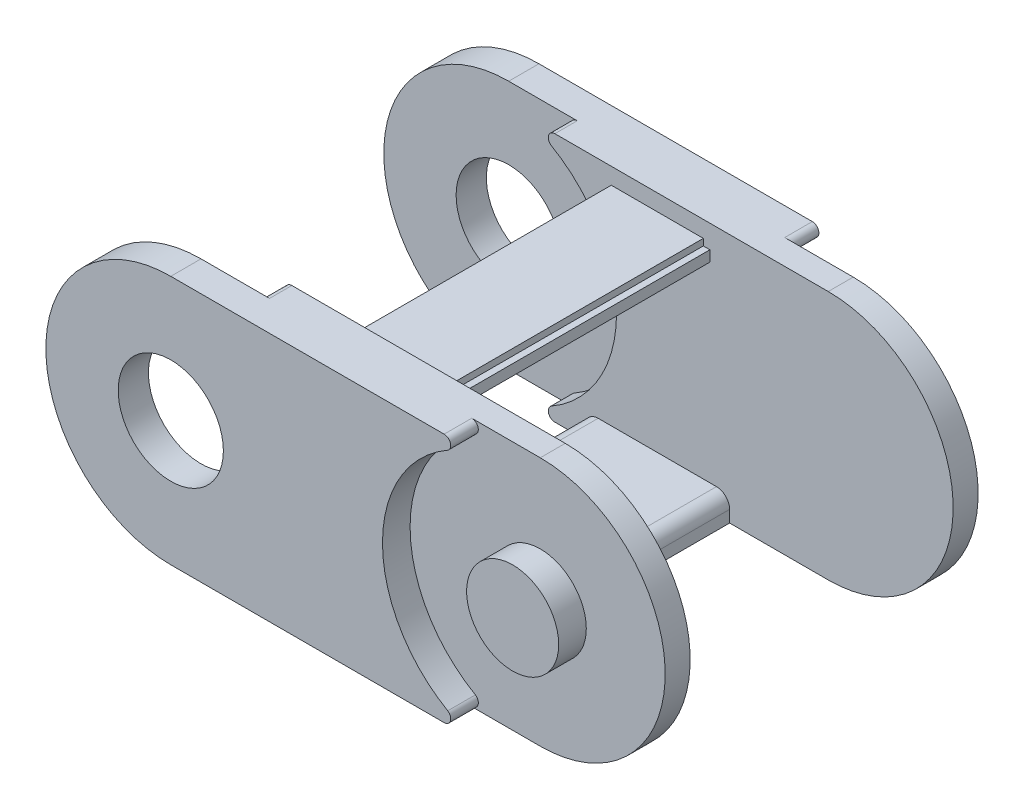
from build123d import *

# Parameters (mm, degrees)
SALIENTE_EXTRUIR1_DEPTH           = 4
CROQUIS2_W                        = 26
CROQUIS2_H                        = 1.9
SALIENTE_EXTRUIR2_DEPTH           = 20
SALIENTE_EXTRUIR3_DEPTH           = 20
SALIENTE_EXTRUIR4_START           = 1.9
SALIENTE_EXTRUIR4_DEPTH           = 1.9
CROQUIS5_W                        = 20
CROQUIS5_H                        = 1.9
CORTAR_EXTRUIR1_DEPTH             = 5.21
CORTAR_EXTRUIR2_START             = -1.7
CORTAR_EXTRUIR2_DEPTH             = 1.7
CROQUIS7_W                        = 20
CROQUIS7_H                        = 1.9
CORTAR_EXTRUIR3_DEPTH             = 2.29
CORTAR_EXTRUIR4_DEPTH             = 20
CORTAR_EXTRUIR5_DEPTH             = 20
CORTAR_EXTRUIR6_DEPTH             = 1.7
CORTAR_EXTRUIR7_START             = -2.1
CORTAR_EXTRUIR7_DEPTH             = 2.1
CROQUIS12_W                       = 20
CROQUIS12_H                       = 1.9
CORTAR_EXTRUIR8_DEPTH             = 7.5
SALIENTE_EXTRUIR5_START           = 2.1
SALIENTE_EXTRUIR5_DEPTH           = 2.1
CROQUIS14_W                       = 3.5
CROQUIS14_H                       = 2.1
CROQUIS15_W                       = 3.5
CROQUIS15_H                       = 2.1
DI_METRO_DE_TALADRO_7_0_7_1_D     = 7
DI_METRO_DE_TALADRO_7_0_7_1_DEPTH = 2.3
DI_METRO_DE_TALADRO_7_0_7_2_D     = 7
DI_METRO_DE_TALADRO_7_0_7_2_DEPTH = 28
NERVIO1_REACH                     = 30.151
CROQUIS20_WALL_W                  = 78.302753042
CROQUIS20_WALL_H                  = 7
REDONDEO1_R                       = 1
CROQUIS21_R                       = 4
CORTAR_EXTRUIR9_DEPTH             = 34


with BuildPart() as part:
    # Croquis1 → Saliente-Extruir1 (new body)
    with BuildSketch(Plane.XY.offset(-10)):
        with BuildLine():
            Line((-13, -9.5), (13, -9.5))
            ThreePointArc((13, -9.5), (22.5, 0), (13, 9.5))
            Line((13, 9.5), (-13, 9.5))
            ThreePointArc((-13, 9.5), (-22.5, 0), (-13, -9.5))
        make_face()
    extrude(amount=-SALIENTE_EXTRUIR1_DEPTH)

    # Croquis2 → Saliente-Extruir2 (add)
    with BuildSketch(Plane.XY.offset(-10)):
        with Locations((0, -8.55)):
            Rectangle(CROQUIS2_W, CROQUIS2_H)
    extrude(amount=SALIENTE_EXTRUIR2_DEPTH)

    # Croquis3 → Saliente-Extruir3 (add)
    with BuildSketch(Plane.XY.offset(-10)):
        with BuildLine():
            Line((-6.2731571, 7.75), (6.2731571, 7.75))
            ThreePointArc((6.2731571, 7.75), (0, 6.4), (-6.2731571, 7.75))
        make_face()
    extrude(amount=SALIENTE_EXTRUIR3_DEPTH)

    # Croquis4 → Saliente-Extruir4 (add)
    with BuildSketch(Plane.XY.offset(10).offset(SALIENTE_EXTRUIR4_START)):
        with BuildLine():
            Line((-13, 9.5), (13, 9.5))
            ThreePointArc((13, 9.5), (22.5, 0), (13, -9.5))
            Line((13, -9.5), (-13, -9.5))
            ThreePointArc((-13, -9.5), (-22.5, 0), (-13, 9.5))
        make_face()
    extrude(amount=-SALIENTE_EXTRUIR4_DEPTH)

    # Croquis5 → Cortar-Extruir1 (cut)
    with BuildSketch(Plane.ZY.offset(13)):
        with Locations((0, -8.55)):
            Rectangle(CROQUIS5_W, CROQUIS5_H)
    extrude(amount=-CORTAR_EXTRUIR1_DEPTH, mode=Mode.SUBTRACT)

    # Croquis6 → Cortar-Extruir2 (cut)
    with BuildSketch(Plane(origin=(0, 0, 10), x_dir=(-1, 0, 0), z_dir=(0, 0, -1)).offset(CORTAR_EXTRUIR2_START)):
        with BuildLine():
            Line((7.79, -9.5), (13, -9.5))
            ThreePointArc((13, -9.5), (22.5, 0), (13, 9.5))
            Line((13, 9.5), (7.79, 9.5))
            ThreePointArc((7.79, 9.5), (8.269213969, 9.142667347), (8.063472742, 8.581415887))
            ThreePointArc((8.063472742, 8.581415887), (3.1, 0), (8.063472742, -8.581415887))
            ThreePointArc((8.063472742, -8.581415887), (8.269213969, -9.142667347), (7.79, -9.5))
        make_face()
    extrude(amount=CORTAR_EXTRUIR2_DEPTH, mode=Mode.SUBTRACT)

    # Croquis7 → Cortar-Extruir3 (cut)
    with BuildSketch(Plane.ZY.offset(7.79)):
        with Locations((0, -8.55)):
            Rectangle(CROQUIS7_W, CROQUIS7_H)
    extrude(amount=-CORTAR_EXTRUIR3_DEPTH, mode=Mode.SUBTRACT)

    # Croquis8 → Cortar-Extruir4 (cut)
    with BuildSketch(Plane(origin=(0, 0, -10), x_dir=(-1, 0, 0), z_dir=(0, 0, -1))):
        with BuildLine():
            Line((4, 7.75), (4, 6.933937347))
            ThreePointArc((4, 6.933937347), (5.152759335, 7.296896808), (6.2731571, 7.75))
            Line((6.2731571, 7.75), (4, 7.75))
        make_face()
    extrude(amount=-CORTAR_EXTRUIR4_DEPTH, mode=Mode.SUBTRACT)

    # Croquis9 → Cortar-Extruir5 (cut)
    with BuildSketch(Plane(origin=(0, 0, -10), x_dir=(-1, 0, 0), z_dir=(0, 0, -1))):
        with BuildLine():
            Line((-4, 6.933937347), (-4, 7.75))
            Line((-4, 7.75), (-6.2731571, 7.75))
            ThreePointArc((-6.2731571, 7.75), (-5.152759335, 7.296896808), (-4, 6.933937347))
        make_face()
    extrude(amount=-CORTAR_EXTRUIR5_DEPTH, mode=Mode.SUBTRACT)

    # Croquis10 → Cortar-Extruir6 (cut)
    with BuildSketch(Plane.XY.offset(-10)):
        with BuildLine():
            Line((-7.79, 9.5), (-13, 9.5))
            ThreePointArc((-13, 9.5), (-22.5, 0), (-13, -9.5))
            Line((-13, -9.5), (-7.79, -9.5))
            ThreePointArc((-7.79, -9.5), (-8.269213969, -9.142667347), (-8.063472742, -8.581415887))
            ThreePointArc((-8.063472742, -8.581415887), (-3.1, 0), (-8.063472742, 8.581415887))
            ThreePointArc((-8.063472742, 8.581415887), (-8.269213969, 9.142667347), (-7.79, 9.5))
        make_face()
    extrude(amount=-CORTAR_EXTRUIR6_DEPTH, mode=Mode.SUBTRACT)

    # Croquis11 → Cortar-Extruir7 (cut)
    with BuildSketch(Plane(origin=(0, 0, -14), x_dir=(-1, 0, 0), z_dir=(0, 0, -1)).offset(CORTAR_EXTRUIR7_START)):
        with BuildLine():
            Line((-13, -9.5), (-7.79, -9.5))
            ThreePointArc((-7.79, -9.5), (-8.269213969, -9.142667347), (-8.063472742, -8.581415887))
            ThreePointArc((-8.063472742, -8.581415887), (-3.1, 0), (-8.063472742, 8.581415887))
            ThreePointArc((-8.063472742, 8.581415887), (-8.269213969, 9.142667347), (-7.79, 9.5))
            Line((-7.79, 9.5), (-13, 9.5))
            ThreePointArc((-13, 9.5), (-22.5, 0), (-13, -9.5))
        make_face()
    extrude(amount=CORTAR_EXTRUIR7_DEPTH, mode=Mode.SUBTRACT)

    # Croquis12 → Cortar-Extruir8 (cut)
    with BuildSketch(Plane(origin=(13, 0, 0), x_dir=(0, 0, -1), z_dir=(1, 0, 0))):
        with Locations((0, -8.55)):
            Rectangle(CROQUIS12_W, CROQUIS12_H)
    extrude(amount=-CORTAR_EXTRUIR8_DEPTH, mode=Mode.SUBTRACT)

    # Croquis13 → Saliente-Extruir5 (add)
    with BuildSketch(Plane.XY.offset(11.9).offset(SALIENTE_EXTRUIR5_START)):
        with BuildLine():
            Line((7.79, -9.5), (-13, -9.5))
            ThreePointArc((-13, -9.5), (-22.5, 0), (-13, 9.5))
            Line((-13, 9.5), (7.79, 9.5))
            ThreePointArc((7.79, 9.5), (8.269213969, 9.142667347), (8.063472742, 8.581415887))
            ThreePointArc((8.063472742, 8.581415887), (3.1, 0), (8.063472742, -8.581415887))
            ThreePointArc((8.063472742, -8.581415887), (8.269213969, -9.142667347), (7.79, -9.5))
        make_face()
    extrude(amount=-SALIENTE_EXTRUIR5_DEPTH)

    # Croquis14 → Revolución1 (revolve)
    with BuildSketch(Plane(origin=(0, 0, 0), x_dir=(1, 0, 0), z_dir=(0, 1, 0))):
        with Locations((14.75, -12.95)):
            Rectangle(CROQUIS14_W, CROQUIS14_H)
    revolve(axis=Axis((13, 0, 11.9), (0, 0, 1)))

    # Croquis15 → Revolución2 (revolve)
    with BuildSketch(Plane.XZ, mode=Mode.PRIVATE) as revoluci_n2_sk:
        with Locations((14.75, -12.95)):
            Rectangle(CROQUIS15_W, CROQUIS15_H)
    revolve(revoluci_n2_sk.sketch.rotate(Axis((13, 0, -11.9), (0, 0, -1)), 180), axis=Axis((13, 0, -11.9), (0, 0, -1)))

    # Diámetro de taladro Ø7.0 (7)1
    with Locations(Plane(origin=(0, 0, 11.7), x_dir=(-1, 0, 0), z_dir=(0, 0, -1))):
        with Locations((13, 0)):
            Hole(DI_METRO_DE_TALADRO_7_0_7_1_D / 2, depth=DI_METRO_DE_TALADRO_7_0_7_1_DEPTH)

    # Diámetro de taladro Ø7.0 (7)2
    with Locations(Plane(origin=(0, 0, -14), x_dir=(-1, 0, 0), z_dir=(0, 0, -1))):
        with Locations((13, 0)):
            Hole(DI_METRO_DE_TALADRO_7_0_7_2_D / 2, depth=DI_METRO_DE_TALADRO_7_0_7_2_DEPTH)

    # Croquis20 wall → Nervio1 (add, up to next)
    with BuildSketch(Plane(origin=(0, 8.25, 0), x_dir=(0, 0, -1), z_dir=(0, -1, 0)), mode=Mode.PRIVATE) as nervio1_sk1:
        Rectangle(CROQUIS20_WALL_W, CROQUIS20_WALL_H)
    nervio1_tool1 = extrude(nervio1_sk1.sketch, amount=NERVIO1_REACH, mode=Mode.PRIVATE) - part.part
    add(nervio1_tool1.solids().sort_by_distance((0, 8.25, 0))[0])

    # Redondeo1
    redondeo1_edges = [part.edges().sort_by_distance(p)[0] for p in [
        (5.5, -7.6, 0),
        (-5.5, -7.6, 0),
    ]]
    fillet(redondeo1_edges, radius=REDONDEO1_R)

    # Croquis21 → Cortar-Extruir9 (cut)
    with BuildSketch(Plane.XY.offset(14)):
        with Locations((-13, 0)):
            Circle(CROQUIS21_R)
    extrude(amount=-CORTAR_EXTRUIR9_DEPTH, mode=Mode.SUBTRACT)


solid = part.part
